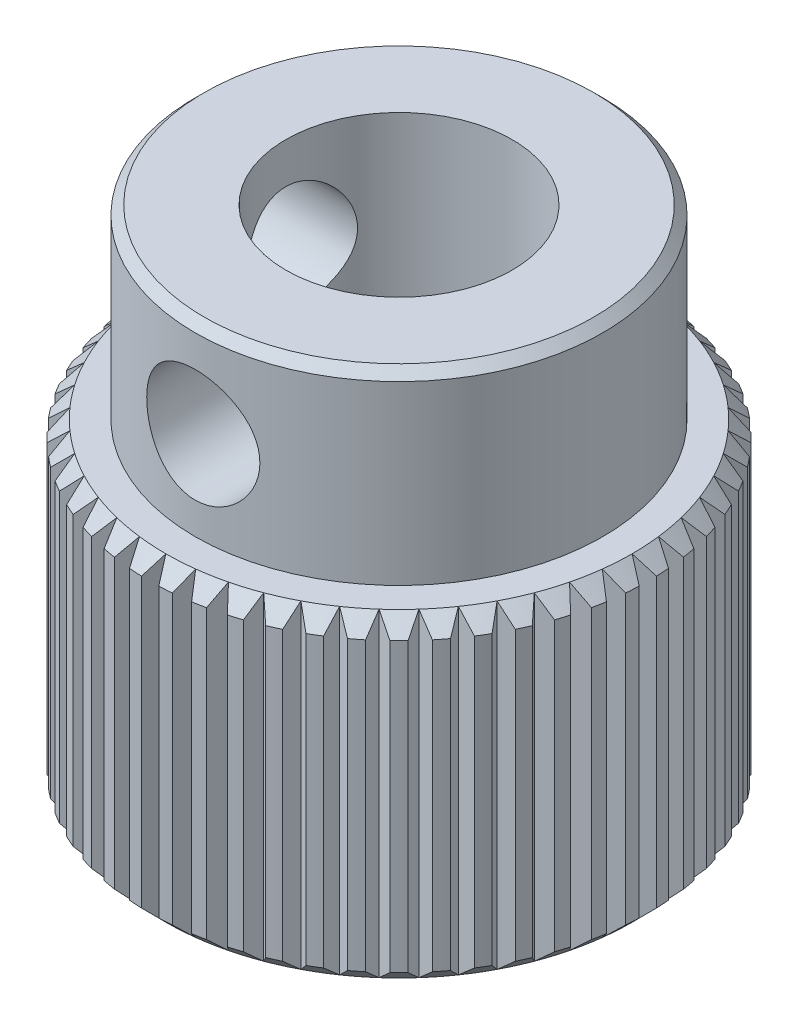
from build123d import *

# Parameters (mm, degrees)
SKETCH1_R                  = 5.5
BOSS_EXTRUDE1_DEPTH        = 5.575
SKETCH3_OUTSIDE_W          = 16.828
SKETCH3_OUTSIDE_H          = 16.828
SKETCH3_OUTSIDE_R          = 4.5
CUT_EXTRUDE2_DEPTH         = 4.1
CHAMFER1_SIZE              = 0.35
CHAMFER2_SIZE              = 0.2
CUT_EXTRUDE1_DEPTH         = 14.594943913
SKETCH4_R                  = 2.5
CUT_EXTRUDE3_DEPTH         = 14.592277538
M3X0_5_TAPPED_HOLE1_REACH  = 16.531
M3X0_5_TAPPED_HOLE1_BORE_R = 1.25
CIRPATTERN1_COUNT          = 2
CIRPATTERN1_ANGLE          = 90


with BuildPart() as part:
    # Sketch1 → Boss-Extrude1 (new, symmetric)
    with BuildSketch(Plane(origin=(0, 0, 0), x_dir=(1, 0, 0), z_dir=(0, 1, 0))):
        with Locations(Location((0, 0, 0), (0, 0, 270))):
            Circle(SKETCH1_R)
    extrude(amount=BOSS_EXTRUDE1_DEPTH, both=True)

    # Sketch3 outside → Cut-Extrude2 (cut)
    with BuildSketch(Plane(origin=(0, 5.575, 0), x_dir=(1, 0, 0), z_dir=(0, 1, 0))):
        Rectangle(SKETCH3_OUTSIDE_W, SKETCH3_OUTSIDE_H)
        with Locations(Location((0, 0, 0), (0, 0, 270))):
            Circle(SKETCH3_OUTSIDE_R, mode=Mode.SUBTRACT)
    extrude(amount=-CUT_EXTRUDE2_DEPTH, mode=Mode.SUBTRACT)

    # Chamfer1
    chamfer1_edges = [part.edges().sort_by_distance(p)[0] for p in [
        (0, -5.575, -5.5),
        (0, 1.475, -5.5),
    ]]
    chamfer(chamfer1_edges, length=CHAMFER1_SIZE)

    # Chamfer2
    chamfer2_edges = [part.edges().sort_by_distance(p)[0] for p in [
        (0, 5.575, -4.5),
    ]]
    chamfer(chamfer2_edges, length=CHAMFER2_SIZE)

    # Sketch2 → Cut-Extrude1 (cut, through all)
    with BuildSketch(Plane(origin=(0, 5.575, 0), x_dir=(1, 0, 0), z_dir=(0, 1, 0))):
        with BuildLine():
            Line((-0.190382937, 5.496703952), (0, 5.15))
            Line((0, 5.15), (0.190382937, 5.496703952))
            ThreePointArc((0.190382937, 5.496703952), (0, 5.5), (-0.190382937, 5.496703952))
        make_face()
        with BuildLine():
            Line((0.473559616, 5.479574919), (0.620763903, 5.112450702))
            Line((0.620763903, 5.112450702), (0.851549278, 5.433678664))
            ThreePointArc((0.851549278, 5.433678664), (0.662951741, 5.459898808), (0.473559616, 5.479574919))
        make_face()
        with BuildLine():
            Line((1.130596603, 5.382541344), (1.232475671, 5.00035036))
            Line((1.232475671, 5.00035036), (1.500298113, 5.291418106))
            ThreePointArc((1.500298113, 5.291418106), (1.316236154, 5.340179996), (1.130596603, 5.382541344))
        make_face()
        with BuildLine():
            Line((1.771146946, 5.207018196), (1.826215168, 4.81533365))
            Line((1.826215168, 4.81533365), (2.127169222, 5.071996757))
            ThreePointArc((2.127169222, 5.071996757), (1.950326879, 5.142589335), (1.771146946, 5.207018196))
        make_face()
        with BuildLine():
            Line((2.385869978, 4.955564998), (2.393324336, 4.560098532))
            Line((2.393324336, 4.560098532), (2.723021415, 4.778614273))
            ThreePointArc((2.723021415, 4.778614273), (2.555977446, 4.870008141), (2.385869978, 4.955564998))
        make_face()
        with BuildLine():
            Line((2.965801653, 4.631848503), (2.925533446, 4.238366909))
            Line((2.925533446, 4.238366909), (3.279165824, 4.415548833))
            ThreePointArc((3.279165824, 4.415548833), (3.124356107, 4.526411262), (2.965801653, 4.631848503))
        make_face()
        with BuildLine():
            Line((3.502485262, 4.240589227), (3.41508169, 3.854830353))
            Line((3.41508169, 3.854830353), (3.787492611, 3.988094748))
            ThreePointArc((3.787492611, 3.988094748), (3.64717462, 4.116809115), (3.502485262, 4.240589227))
        make_face()
        with BuildLine():
            Line((3.988094748, 3.787492611), (3.854830353, 3.41508169))
            Line((3.854830353, 3.41508169), (4.240589227, 3.502485262))
            ThreePointArc((4.240589227, 3.502485262), (4.116809115, 3.64717462), (3.988094748, 3.787492611))
        make_face()
        with BuildLine():
            Line((4.415548833, 3.279165824), (4.238366909, 2.925533446))
            Line((4.238366909, 2.925533446), (4.631848503, 2.965801653))
            ThreePointArc((4.631848503, 2.965801653), (4.526411262, 3.124356107), (4.415548833, 3.279165824))
        make_face()
        with BuildLine():
            Line((4.778614273, 2.723021415), (4.560098532, 2.393324336))
            Line((4.560098532, 2.393324336), (4.955564998, 2.385869978))
            ThreePointArc((4.955564998, 2.385869978), (4.870008141, 2.555977446), (4.778614273, 2.723021415))
        make_face()
        with BuildLine():
            Line((5.071996757, 2.127169222), (4.81533365, 1.826215168))
            Line((4.81533365, 1.826215168), (5.207018196, 1.771146946))
            ThreePointArc((5.207018196, 1.771146946), (5.142589335, 1.950326879), (5.071996757, 2.127169222))
        make_face()
        with BuildLine():
            Line((5.291418106, 1.500298113), (5.00035036, 1.232475671))
            Line((5.00035036, 1.232475671), (5.382541344, 1.130596603))
            ThreePointArc((5.382541344, 1.130596603), (5.340179996, 1.316236154), (5.291418106, 1.500298113))
        make_face()
        with BuildLine():
            Line((5.433678664, 0.851549278), (5.112450702, 0.620763903))
            Line((5.112450702, 0.620763903), (5.479574919, 0.473559616))
            ThreePointArc((5.479574919, 0.473559616), (5.459898808, 0.662951741), (5.433678664, 0.851549278))
        make_face()
        with BuildLine():
            Line((5.496703952, 0.190382937), (5.15, 0))
            Line((5.15, 0), (5.496703952, -0.190382937))
            ThreePointArc((5.496703952, -0.190382937), (5.5, 0), (5.496703952, 0.190382937))
        make_face()
        with BuildLine():
            Line((5.479574919, -0.473559616), (5.112450702, -0.620763903))
            Line((5.112450702, -0.620763903), (5.433678664, -0.851549278))
            ThreePointArc((5.433678664, -0.851549278), (5.459898808, -0.662951741), (5.479574919, -0.473559616))
        make_face()
        with BuildLine():
            Line((5.382541344, -1.130596603), (5.00035036, -1.232475671))
            Line((5.00035036, -1.232475671), (5.291418106, -1.500298113))
            ThreePointArc((5.291418106, -1.500298113), (5.340179996, -1.316236154), (5.382541344, -1.130596603))
        make_face()
        with BuildLine():
            Line((5.207018196, -1.771146946), (4.81533365, -1.826215168))
            Line((4.81533365, -1.826215168), (5.071996757, -2.127169222))
            ThreePointArc((5.071996757, -2.127169222), (5.142589335, -1.950326879), (5.207018196, -1.771146946))
        make_face()
        with BuildLine():
            Line((4.955564998, -2.385869978), (4.560098532, -2.393324336))
            Line((4.560098532, -2.393324336), (4.778614273, -2.723021415))
            ThreePointArc((4.778614273, -2.723021415), (4.870008141, -2.555977446), (4.955564998, -2.385869978))
        make_face()
        with BuildLine():
            Line((4.631848503, -2.965801653), (4.238366909, -2.925533446))
            Line((4.238366909, -2.925533446), (4.415548833, -3.279165824))
            ThreePointArc((4.415548833, -3.279165824), (4.526411262, -3.124356107), (4.631848503, -2.965801653))
        make_face()
        with BuildLine():
            Line((4.240589227, -3.502485262), (3.854830353, -3.41508169))
            Line((3.854830353, -3.41508169), (3.988094748, -3.787492611))
            ThreePointArc((3.988094748, -3.787492611), (4.116809115, -3.64717462), (4.240589227, -3.502485262))
        make_face()
        with BuildLine():
            Line((3.787492611, -3.988094748), (3.41508169, -3.854830353))
            Line((3.41508169, -3.854830353), (3.502485262, -4.240589227))
            ThreePointArc((3.502485262, -4.240589227), (3.64717462, -4.116809115), (3.787492611, -3.988094748))
        make_face()
        with BuildLine():
            Line((3.279165824, -4.415548833), (2.925533446, -4.238366909))
            Line((2.925533446, -4.238366909), (2.965801653, -4.631848503))
            ThreePointArc((2.965801653, -4.631848503), (3.124356107, -4.526411262), (3.279165824, -4.415548833))
        make_face()
        with BuildLine():
            Line((2.723021415, -4.778614273), (2.393324336, -4.560098532))
            Line((2.393324336, -4.560098532), (2.385869978, -4.955564998))
            ThreePointArc((2.385869978, -4.955564998), (2.555977446, -4.870008141), (2.723021415, -4.778614273))
        make_face()
        with BuildLine():
            Line((2.127169222, -5.071996757), (1.826215168, -4.81533365))
            Line((1.826215168, -4.81533365), (1.771146946, -5.207018196))
            ThreePointArc((1.771146946, -5.207018196), (1.950326879, -5.142589335), (2.127169222, -5.071996757))
        make_face()
        with BuildLine():
            Line((1.500298113, -5.291418106), (1.232475671, -5.00035036))
            Line((1.232475671, -5.00035036), (1.130596603, -5.382541344))
            ThreePointArc((1.130596603, -5.382541344), (1.316236154, -5.340179996), (1.500298113, -5.291418106))
        make_face()
        with BuildLine():
            Line((0.851549278, -5.433678664), (0.620763903, -5.112450702))
            Line((0.620763903, -5.112450702), (0.473559616, -5.479574919))
            ThreePointArc((0.473559616, -5.479574919), (0.662951741, -5.459898808), (0.851549278, -5.433678664))
        make_face()
        with BuildLine():
            Line((0.190382937, -5.496703952), (0, -5.15))
            Line((0, -5.15), (-0.190382937, -5.496703952))
            ThreePointArc((-0.190382937, -5.496703952), (0, -5.5), (0.190382937, -5.496703952))
        make_face()
        with BuildLine():
            Line((-0.473559616, -5.479574919), (-0.620763903, -5.112450702))
            Line((-0.620763903, -5.112450702), (-0.851549278, -5.433678664))
            ThreePointArc((-0.851549278, -5.433678664), (-0.662951741, -5.459898808), (-0.473559616, -5.479574919))
        make_face()
        with BuildLine():
            Line((-1.130596603, -5.382541344), (-1.232475671, -5.00035036))
            Line((-1.232475671, -5.00035036), (-1.500298113, -5.291418106))
            ThreePointArc((-1.500298113, -5.291418106), (-1.316236154, -5.340179996), (-1.130596603, -5.382541344))
        make_face()
        with BuildLine():
            Line((-1.771146946, -5.207018196), (-1.826215168, -4.81533365))
            Line((-1.826215168, -4.81533365), (-2.127169222, -5.071996757))
            ThreePointArc((-2.127169222, -5.071996757), (-1.950326879, -5.142589335), (-1.771146946, -5.207018196))
        make_face()
        with BuildLine():
            Line((-2.385869978, -4.955564998), (-2.393324336, -4.560098532))
            Line((-2.393324336, -4.560098532), (-2.723021415, -4.778614273))
            ThreePointArc((-2.723021415, -4.778614273), (-2.555977446, -4.870008141), (-2.385869978, -4.955564998))
        make_face()
        with BuildLine():
            Line((-2.965801653, -4.631848503), (-2.925533446, -4.238366909))
            Line((-2.925533446, -4.238366909), (-3.279165824, -4.415548833))
            ThreePointArc((-3.279165824, -4.415548833), (-3.124356107, -4.526411262), (-2.965801653, -4.631848503))
        make_face()
        with BuildLine():
            Line((-3.502485262, -4.240589227), (-3.41508169, -3.854830353))
            Line((-3.41508169, -3.854830353), (-3.787492611, -3.988094748))
            ThreePointArc((-3.787492611, -3.988094748), (-3.64717462, -4.116809115), (-3.502485262, -4.240589227))
        make_face()
        with BuildLine():
            Line((-3.988094748, -3.787492611), (-3.854830353, -3.41508169))
            Line((-3.854830353, -3.41508169), (-4.240589227, -3.502485262))
            ThreePointArc((-4.240589227, -3.502485262), (-4.116809115, -3.64717462), (-3.988094748, -3.787492611))
        make_face()
        with BuildLine():
            Line((-4.415548833, -3.279165824), (-4.238366909, -2.925533446))
            Line((-4.238366909, -2.925533446), (-4.631848503, -2.965801653))
            ThreePointArc((-4.631848503, -2.965801653), (-4.526411262, -3.124356107), (-4.415548833, -3.279165824))
        make_face()
        with BuildLine():
            Line((-4.778614273, -2.723021415), (-4.560098532, -2.393324336))
            Line((-4.560098532, -2.393324336), (-4.955564998, -2.385869978))
            ThreePointArc((-4.955564998, -2.385869978), (-4.870008141, -2.555977446), (-4.778614273, -2.723021415))
        make_face()
        with BuildLine():
            Line((-5.071996757, -2.127169222), (-4.81533365, -1.826215168))
            Line((-4.81533365, -1.826215168), (-5.207018196, -1.771146946))
            ThreePointArc((-5.207018196, -1.771146946), (-5.142589335, -1.950326879), (-5.071996757, -2.127169222))
        make_face()
        with BuildLine():
            Line((-5.291418106, -1.500298113), (-5.00035036, -1.232475671))
            Line((-5.00035036, -1.232475671), (-5.382541344, -1.130596603))
            ThreePointArc((-5.382541344, -1.130596603), (-5.340179996, -1.316236154), (-5.291418106, -1.500298113))
        make_face()
        with BuildLine():
            Line((-5.433678664, -0.851549278), (-5.112450702, -0.620763903))
            Line((-5.112450702, -0.620763903), (-5.479574919, -0.473559616))
            ThreePointArc((-5.479574919, -0.473559616), (-5.459898808, -0.662951741), (-5.433678664, -0.851549278))
        make_face()
        with BuildLine():
            Line((-5.496703952, -0.190382937), (-5.15, 0))
            Line((-5.15, 0), (-5.496703952, 0.190382937))
            ThreePointArc((-5.496703952, 0.190382937), (-5.5, 0), (-5.496703952, -0.190382937))
        make_face()
        with BuildLine():
            Line((-5.479574919, 0.473559616), (-5.112450702, 0.620763903))
            Line((-5.112450702, 0.620763903), (-5.433678664, 0.851549278))
            ThreePointArc((-5.433678664, 0.851549278), (-5.459898808, 0.662951741), (-5.479574919, 0.473559616))
        make_face()
        with BuildLine():
            Line((-5.382541344, 1.130596603), (-5.00035036, 1.232475671))
            Line((-5.00035036, 1.232475671), (-5.291418106, 1.500298113))
            ThreePointArc((-5.291418106, 1.500298113), (-5.340179996, 1.316236154), (-5.382541344, 1.130596603))
        make_face()
        with BuildLine():
            Line((-5.207018196, 1.771146946), (-4.81533365, 1.826215168))
            Line((-4.81533365, 1.826215168), (-5.071996757, 2.127169222))
            ThreePointArc((-5.071996757, 2.127169222), (-5.142589335, 1.950326879), (-5.207018196, 1.771146946))
        make_face()
        with BuildLine():
            Line((-4.955564998, 2.385869978), (-4.560098532, 2.393324336))
            Line((-4.560098532, 2.393324336), (-4.778614273, 2.723021415))
            ThreePointArc((-4.778614273, 2.723021415), (-4.870008141, 2.555977446), (-4.955564998, 2.385869978))
        make_face()
        with BuildLine():
            Line((-4.631848503, 2.965801653), (-4.238366909, 2.925533446))
            Line((-4.238366909, 2.925533446), (-4.415548833, 3.279165824))
            ThreePointArc((-4.415548833, 3.279165824), (-4.526411262, 3.124356107), (-4.631848503, 2.965801653))
        make_face()
        with BuildLine():
            Line((-4.240589227, 3.502485262), (-3.854830353, 3.41508169))
            Line((-3.854830353, 3.41508169), (-3.988094748, 3.787492611))
            ThreePointArc((-3.988094748, 3.787492611), (-4.116809115, 3.64717462), (-4.240589227, 3.502485262))
        make_face()
        with BuildLine():
            Line((-3.787492611, 3.988094748), (-3.41508169, 3.854830353))
            Line((-3.41508169, 3.854830353), (-3.502485262, 4.240589227))
            ThreePointArc((-3.502485262, 4.240589227), (-3.64717462, 4.116809115), (-3.787492611, 3.988094748))
        make_face()
        with BuildLine():
            Line((-3.279165824, 4.415548833), (-2.925533446, 4.238366909))
            Line((-2.925533446, 4.238366909), (-2.965801653, 4.631848503))
            ThreePointArc((-2.965801653, 4.631848503), (-3.124356107, 4.526411262), (-3.279165824, 4.415548833))
        make_face()
        with BuildLine():
            Line((-2.723021415, 4.778614273), (-2.393324336, 4.560098532))
            Line((-2.393324336, 4.560098532), (-2.385869978, 4.955564998))
            ThreePointArc((-2.385869978, 4.955564998), (-2.555977446, 4.870008141), (-2.723021415, 4.778614273))
        make_face()
        with BuildLine():
            Line((-2.127169222, 5.071996757), (-1.826215168, 4.81533365))
            Line((-1.826215168, 4.81533365), (-1.771146946, 5.207018196))
            ThreePointArc((-1.771146946, 5.207018196), (-1.950326879, 5.142589335), (-2.127169222, 5.071996757))
        make_face()
        with BuildLine():
            Line((-1.500298113, 5.291418106), (-1.232475671, 5.00035036))
            Line((-1.232475671, 5.00035036), (-1.130596603, 5.382541344))
            ThreePointArc((-1.130596603, 5.382541344), (-1.316236154, 5.340179996), (-1.500298113, 5.291418106))
        make_face()
        with BuildLine():
            Line((-0.851549278, 5.433678664), (-0.620763903, 5.112450702))
            Line((-0.620763903, 5.112450702), (-0.473559616, 5.479574919))
            ThreePointArc((-0.473559616, 5.479574919), (-0.662951741, 5.459898808), (-0.851549278, 5.433678664))
        make_face()
    extrude(amount=-CUT_EXTRUDE1_DEPTH, mode=Mode.SUBTRACT)

    # Sketch4 → Cut-Extrude3 (cut, through all)
    with BuildSketch(Plane(origin=(0, 5.575, 0), x_dir=(1, 0, 0), z_dir=(0, 1, 0))):
        with Locations(Location((0, 0, 0), (0, 0, 270))):
            Circle(SKETCH4_R)
    extrude(amount=-CUT_EXTRUDE3_DEPTH, mode=Mode.SUBTRACT)

    # M3x0.5 Tapped Hole1 bore (on position points) → M3x0.5 Tapped Hole1 (cut, up to next)
    with BuildSketch(Plane(origin=(0, 3.425, 4.5), x_dir=(1, 0, 0), z_dir=(0, 0, 1)), mode=Mode.PRIVATE) as m3x0_5_tapped_hole1_sk1:
        Circle(M3X0_5_TAPPED_HOLE1_BORE_R)
    m3x0_5_tapped_hole1_tool1 = extrude(m3x0_5_tapped_hole1_sk1.sketch, amount=-M3X0_5_TAPPED_HOLE1_REACH, mode=Mode.PRIVATE) & part.part
    m3x0_5_tapped_hole1 = m3x0_5_tapped_hole1_tool1.solids().sort_by_distance((0, 3.425, 4.5))[0]
    add(m3x0_5_tapped_hole1, mode=Mode.SUBTRACT)

    # CirPattern1: M3x0.5 Tapped Hole1 ×2 about axis
    cirpattern1_axis = Axis((0, 1.475, 0), (0, -1, 0))
    for i in range(1, CIRPATTERN1_COUNT):
        add(m3x0_5_tapped_hole1.rotate(cirpattern1_axis, i * CIRPATTERN1_ANGLE / (CIRPATTERN1_COUNT - 1)), mode=Mode.SUBTRACT)


solid = part.part
